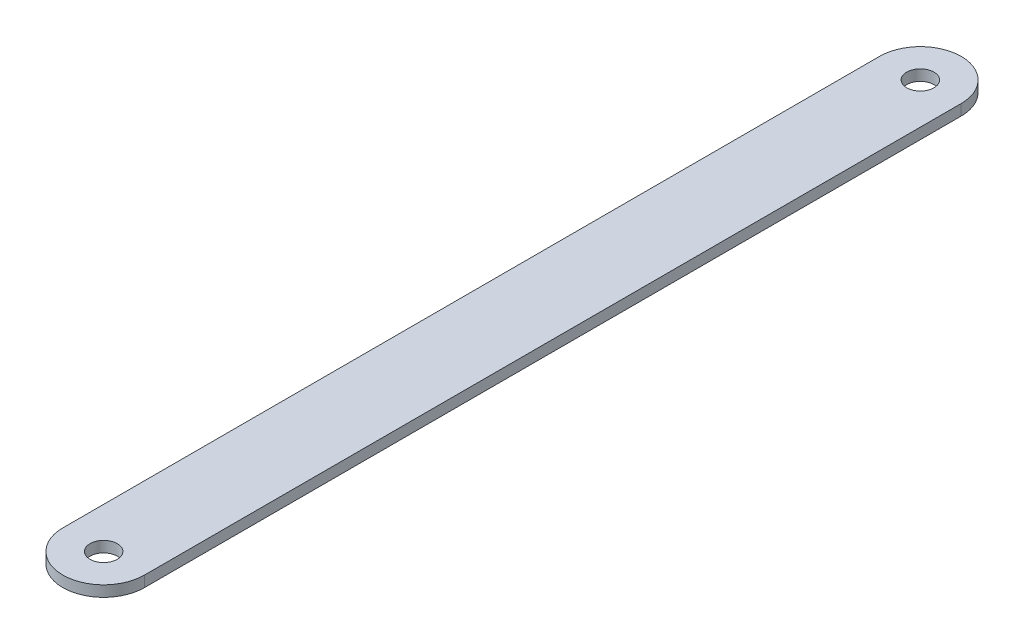
from build123d import *

# Parameters (mm, degrees)
BOSS_EXTRUDE1_DEPTH = 1
SKETCH3_R           = 2.5
CUT_EXTRUDE2_DEPTH  = 2


with BuildPart() as part:
    # Sketch1 → Boss-Extrude1 (new, symmetric)
    with BuildSketch(Plane(origin=(0, 0, 0), x_dir=(1, 0, 0), z_dir=(0, 1, 0))):
        with BuildLine():
            Line((-15.654761905, 108.511904762), (-15.654761905, -41.488095238))
            ThreePointArc((-15.654761905, -41.488095238), (-8.154761905, -48.988095238), (-0.654761905, -41.488095238))
            Line((-0.654761905, -41.488095238), (-0.654761905, 108.511904762))
            ThreePointArc((-0.654761905, 108.511904762), (-8.154761905, 116.011904762), (-15.654761905, 108.511904762))
        make_face()
    extrude(amount=BOSS_EXTRUDE1_DEPTH, both=True)

    # Sketch3 → Cut-Extrude2 (cut)
    with BuildSketch(Plane(origin=(0, 1, 0), x_dir=(1, 0, 0), z_dir=(0, 1, 0))):
        with Locations(Location((-8.154761905, 108.511904762, 0), (0, 0, 270))):
            Circle(SKETCH3_R)
        with Locations(Location((-8.154761905, -41.488095238, 0), (0, 0, 270))):
            Circle(SKETCH3_R)
    extrude(amount=-CUT_EXTRUDE2_DEPTH, mode=Mode.SUBTRACT)


solid = part.part
